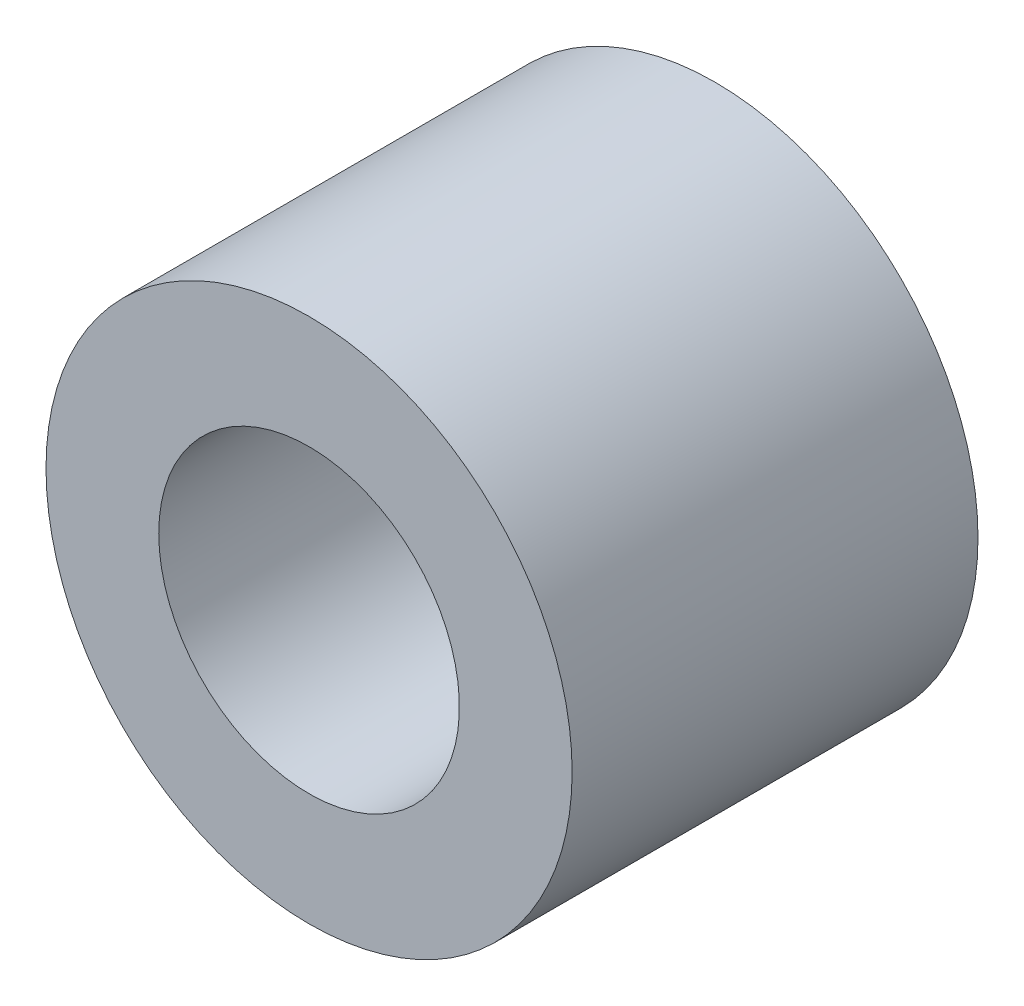
from build123d import *

# Parameters (mm, degrees)
SKETCH_1_R      = 3.5
SKETCH_1_R_2    = 2
EXTRUDE_1_DEPTH = 5.4


with BuildPart() as part:
    # 草图1 → 凸台-拉伸1 (new body)
    with BuildSketch(Plane.XY):
        with Locations(Location((0, 0, 0), (0, 0, 180))):
            Circle(SKETCH_1_R)
        with Locations(Location((0, 0, 0), (0, 0, 180))):
            Circle(SKETCH_1_R_2, mode=Mode.SUBTRACT)
    extrude(amount=EXTRUDE_1_DEPTH)


solid = part.part
